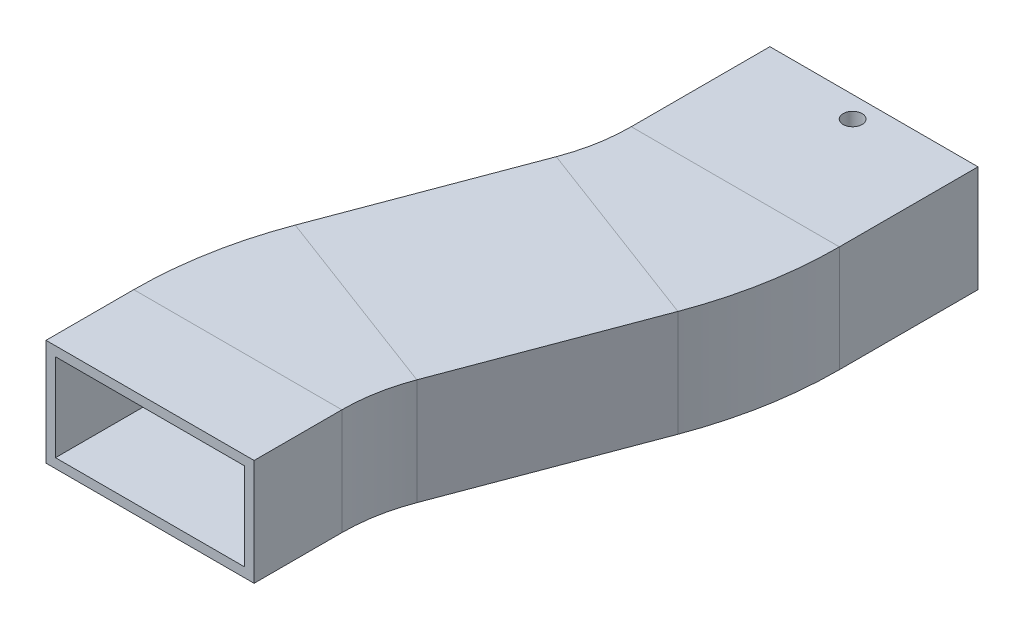
from build123d import *

# Parameters (mm, degrees)
SKETCH1_W           = 43.9
SKETCH1_H           = 22.45
SKETCH1_W_2         = 39.9
SKETCH1_H_2         = 18.45
SKETCH4_W           = 10.037411494
SKETCH4_H           = 9.392939089
BOSS_EXTRUDE2_DEPTH = 6
SKETCH4_3_R         = 2
CUT_EXTRUDE1_DEPTH  = 6


with BuildPart() as part:
    # Sweep1: sweep along a path in Sketch3
    with BuildLine(Plane(origin=(0, 0, 0), x_dir=(1, 0, 0), z_dir=(0, 1, 0))) as sweep1_path:
        Line((-2.386481251, 0), (-2.386481251, 18.515328192))
        ThreePointArc((-2.386481251, 18.515328192), (-1.420266616, 29.239701623), (1.447258265, 39.618673501))
        Line((1.447258265, 39.618673501), (16.488375541, 79.650398262))
        ThreePointArc((16.488375541, 79.650398262), (19.355900422, 90.02937014), (20.322115057, 100.753743571))
        Line((20.322115057, 100.753743571), (20.322115057, 130))
    # Sketch1 → Sweep1 (sweep)
    with BuildSketch(Plane.XY):
        with Locations((-2.386481251, 2.5875622)):
            Rectangle(SKETCH1_W, SKETCH1_H)
        with Locations((-2.386481251, 2.5875622)):
            Rectangle(SKETCH1_W_2, SKETCH1_H_2, mode=Mode.SUBTRACT)
    sweep(path=sweep1_path.line)

    # Sketch4 → Boss-Extrude2 (add)
    with BuildSketch(Plane(origin=(0, 13.8125622, 0), x_dir=(1, 0, 0), z_dir=(0, 1, 0))):
        with Locations((20.322115057, 125.303530456)):
            Rectangle(SKETCH4_W, SKETCH4_H)
    extrude(amount=-BOSS_EXTRUDE2_DEPTH)

    # Sketch4<3> → Cut-Extrude1 (cut)
    with BuildSketch(Plane(origin=(0, 13.8125622, 0), x_dir=(1, 0, 0), z_dir=(0, 1, 0))):
        with Locations((20.322115057, 125.5)):
            Circle(SKETCH4_3_R)
    extrude(amount=-CUT_EXTRUDE1_DEPTH, mode=Mode.SUBTRACT)


solid = part.part
